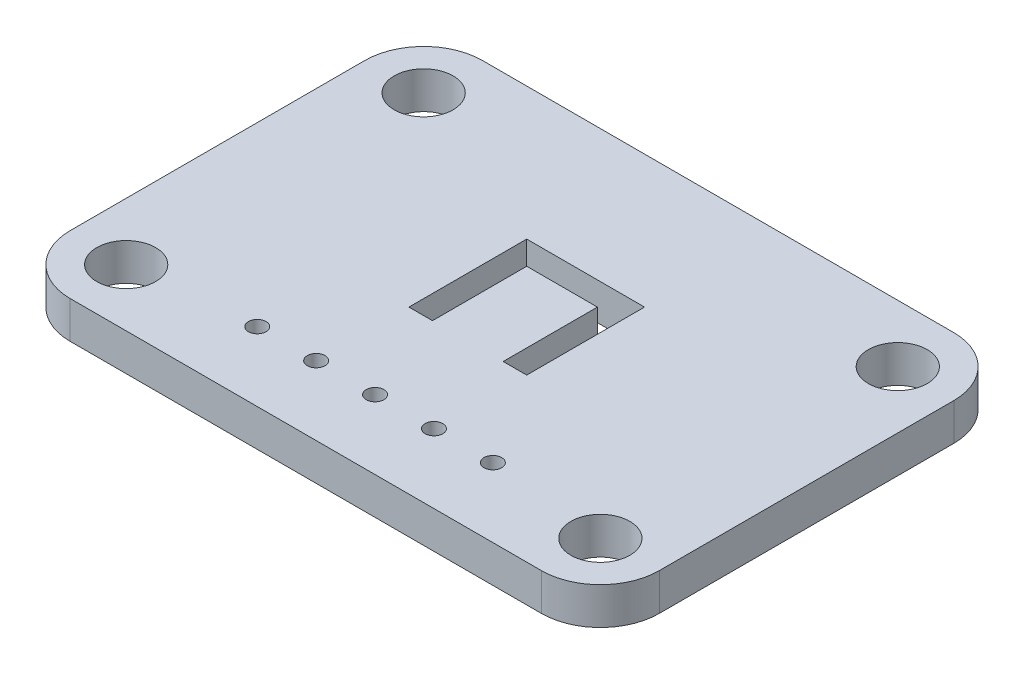
from build123d import *

# Parameters (mm, degrees)
SKETCH1_R           = 1.27
BOSS_EXTRUDE1_DEPTH = 1.6
SKETCH2_W           = 13.208
SKETCH2_H           = 2.667
BOSS_EXTRUDE2_DEPTH = 2.159
SKETCH3_R           = 0.381
CUT_EXTRUDE1_DEPTH  = 16.951557322
SKETCH4_W           = 5.111032259
SKETCH4_H           = 3.147597235
CUT_EXTRUDE2_DEPTH  = 27.997284697
CUT_EXTRUDE3_DEPTH  = 0.0254


with BuildPart() as part:
    # Sketch1 → Boss-Extrude1 (new body)
    with BuildSketch(Plane(origin=(0, 0, 0), x_dir=(1, 0, 0), z_dir=(0, 1, 0))):
        with BuildLine():
            Line((10.16, 8.89), (-10.16, 8.89))
            ThreePointArc((-10.16, 8.89), (-11.956051224, 8.146051224), (-12.7, 6.35))
            Line((-12.7, 6.35), (-12.7, -6.35))
            ThreePointArc((-12.7, -6.35), (-11.956051224, -8.146051224), (-10.16, -8.89))
            Line((-10.16, -8.89), (10.16, -8.89))
            ThreePointArc((10.16, -8.89), (11.956051224, -8.146051224), (12.7, -6.35))
            Line((12.7, -6.35), (12.7, 6.35))
            ThreePointArc((12.7, 6.35), (11.956051224, 8.146051224), (10.16, 8.89))
        make_face()
        with Locations(Location((-10.2235, 6.4135, 0), (0, 0, 270))):
            Circle(SKETCH1_R, mode=Mode.SUBTRACT)
        with Locations(Location((10.2235, 6.4135, 0), (0, 0, 270))):
            Circle(SKETCH1_R, mode=Mode.SUBTRACT)
        with Locations(Location((-10.2235, -6.4135, 0), (0, 0, 270))):
            Circle(SKETCH1_R, mode=Mode.SUBTRACT)
        with Locations(Location((10.2235, -6.4135, 0), (0, 0, 270))):
            Circle(SKETCH1_R, mode=Mode.SUBTRACT)
        Polygon((-2.54, -1.905), (-1.524, -1.905), (-1.524, 2.159), (1.524, 2.159), (1.524, -1.905), (2.54, -1.905), (2.54, 3.175), (-2.54, 3.175), align=None, mode=Mode.SUBTRACT)
    extrude(amount=BOSS_EXTRUDE1_DEPTH)

    # Sketch2 → Boss-Extrude2 (add)
    with BuildSketch(Plane.XZ):
        with Locations((0, 5.9055)):
            Rectangle(SKETCH2_W, SKETCH2_H)
    extrude(amount=BOSS_EXTRUDE2_DEPTH)

    # Sketch3 → Cut-Extrude1 (cut, through all)
    with BuildSketch(Plane.XZ.offset(2.159)):
        with Locations(Location((-5.08, 5.9055, 0), (0, 0, 270))):
            Circle(SKETCH3_R)
        with Locations(Location((-2.54, 5.9055, 0), (0, 0, 270))):
            Circle(SKETCH3_R)
        with Locations(Location((0, 5.9055, 0), (0, 0, 270))):
            Circle(SKETCH3_R)
        with Locations(Location((2.54, 5.9055, 0), (0, 0, 270))):
            Circle(SKETCH3_R)
        with Locations(Location((5.08, 5.9055, 0), (0, 0, 270))):
            Circle(SKETCH3_R)
    extrude(amount=-CUT_EXTRUDE1_DEPTH, mode=Mode.SUBTRACT)

    # Sketch4 → Cut-Extrude2 (cut, through all)
    with BuildSketch(Plane.ZY.offset(12.7)):
        with Locations((5.923321313, -1.573798618)):
            Rectangle(SKETCH4_W, SKETCH4_H)
    extrude(amount=-CUT_EXTRUDE2_DEPTH, mode=Mode.SUBTRACT)

    # Sketch5 → Cut-Extrude3 (cut)
    # profile 1 of 5: a face of its own
    with BuildSketch(Plane.XZ):
        with BuildLine():
            Line((-5.74673112, -6.610759593), (-5.478331681, -6.449847133))
            add(Edge.make_bspline(
                [(-5.478331681, -6.449847133), (-5.453368708, -6.491634111), (-5.405540617, -6.571696348), (-5.325756169, -6.679880427), (-5.2430856, -6.771830384), (-5.156916704, -6.847011306), (-5.067775451, -6.906201368), (-4.975079917, -6.948113392), (-4.879142474, -6.974253599), (-4.813851936, -6.977428677), (-4.78125636, -6.9790138)],
                knots=[0, 0, 0, 0, 1.272034388, 2.437168799, 3.508375237, 4.49857839, 5.41946034, 6.295179144, 7.148887113, 8, 8, 8, 8], degree=3))
            add(Edge.make_bspline(
                [(-4.78125636, -6.9790138), (-4.753418994, -6.97823849), (-4.69823135, -6.976701436), (-4.616985601, -6.961932422), (-4.53808068, -6.939242848), (-4.463142844, -6.906748146), (-4.393206108, -6.867433948), (-4.331877178, -6.819948487), (-4.278858203, -6.766784286), (-4.235488507, -6.707472878), (-4.202214475, -6.643685179), (-4.176640241, -6.578211281), (-4.162447924, -6.510022651), (-4.160310012, -6.464111731), (-4.15923112, -6.440942886)],
                knots=[0, 0, 0, 0, 1.095163259, 2.171163733, 3.241058638, 4.321873601, 5.38011039, 6.391990106, 7.366004449, 8.327778327, 9.272591725, 10.192022065, 11.087607919, 12, 12, 12, 12], degree=3))
            add(Edge.make_bspline(
                [(-4.15923112, -6.440942886), (-4.16056853, -6.414507973), (-4.16328729, -6.360769656), (-4.186266561, -6.281485685), (-4.222415521, -6.203024568), (-4.255764491, -6.154491277), (-4.273078275, -6.129294249)],
                knots=[0, 0, 0, 0, 0.938893495, 1.908633276, 2.914225137, 4, 4, 4, 4], degree=3))
            add(Edge.make_bspline(
                [(-4.273078275, -6.129294249), (-4.287293761, -6.111108916), (-4.317137395, -6.072931084), (-4.368443139, -6.016102906), (-4.428646685, -5.957484769), (-4.495687767, -5.894838339), (-4.572008498, -5.831077266), (-4.655218457, -5.763161043), (-4.747442101, -5.693672469), (-4.81212093, -5.647070213), (-4.845494141, -5.623024216)],
                knots=[0, 0, 0, 0, 0.722233717, 1.516239348, 2.393582979, 3.351407094, 4.387010283, 5.505090956, 6.712668013, 8, 8, 8, 8], degree=3))
            add(Edge.make_bspline(
                [(-4.845494141, -5.623024216), (-4.878898766, -5.599231141), (-4.942765865, -5.553740591), (-5.032081865, -5.486227134), (-5.111950771, -5.424501623), (-5.182017593, -5.367982984), (-5.242251513, -5.31666355), (-5.293127178, -5.271036133), (-5.333348584, -5.22986676), (-5.355714718, -5.203159257), (-5.36575656, -5.191168247)],
                knots=[0, 0, 0, 0, 1.452282411, 2.77665338, 3.964542531, 5.026858415, 5.96415736, 6.766646006, 7.446254459, 8, 8, 8, 8], degree=3))
            add(Edge.make_bspline(
                [(-5.36575656, -5.191168247), (-5.379792369, -5.172480163), (-5.407395671, -5.135727539), (-5.443831976, -5.078282847), (-5.474801074, -5.019478885), (-5.499078332, -4.959157636), (-5.519521902, -4.898165951), (-5.533272311, -4.835708035), (-5.541882364, -4.772064145), (-5.542764094, -4.729234755), (-5.543205479, -4.707794849)],
                knots=[0, 0, 0, 0, 1.068054152, 2.10047183, 3.106115577, 4.101338837, 5.06977816, 6.043150881, 7.020423561, 8, 8, 8, 8], degree=3))
            add(Edge.make_bspline(
                [(-5.543205479, -4.707794849), (-5.542021468, -4.674203554), (-5.539678753, -4.607738953), (-5.519866284, -4.5106467), (-5.488594445, -4.417949022), (-5.444784082, -4.330563647), (-5.388307769, -4.250765936), (-5.322951778, -4.177637987), (-5.245108501, -4.116162202), (-5.159698621, -4.062448406), (-5.06621177, -4.020406031), (-4.968248593, -3.988691428), (-4.865653392, -3.970721601), (-4.796163406, -3.968142807), (-4.760903796, -3.966834313)],
                knots=[0, 0, 0, 0, 1.005424448, 1.989358655, 2.955360095, 3.929531133, 4.905563448, 5.876582895, 6.856512386, 7.866279853, 8.892233794, 9.918561126, 10.94386622, 12, 12, 12, 12], degree=3))
            add(Edge.make_bspline(
                [(-4.760903796, -3.966834313), (-4.723489505, -3.96812477), (-4.649084422, -3.970691078), (-4.539638347, -3.993004553), (-4.434263983, -4.029925877), (-4.349497593, -4.071825588), (-4.283155731, -4.113673372), (-4.232561895, -4.151791356), (-4.181292493, -4.19567449), (-4.128933972, -4.245439663), (-4.076373517, -4.301543502), (-4.022830813, -4.363601769), (-3.968180655, -4.431235217), (-3.933023554, -4.479517442), (-3.91500035, -4.504269208)],
                knots=[0, 0, 0, 0, 1.286793592, 2.559021753, 3.825965368, 5.121522368, 5.803751409, 6.523245864, 7.299691795, 8.125521123, 9.008227632, 9.944561021, 10.946284179, 12, 12, 12, 12], degree=3))
            Line((-3.91500035, -4.504269208), (-4.17258749, -4.69952662))
            add(Edge.make_bspline(
                [(-4.17258749, -4.69952662), (-4.1881413, -4.679489023), (-4.218094302, -4.640901294), (-4.263568908, -4.586861601), (-4.306430181, -4.53749808), (-4.348658044, -4.494621857), (-4.388022267, -4.455884922), (-4.426228441, -4.422719999), (-4.462726745, -4.394802138), (-4.508734228, -4.365008337), (-4.566535301, -4.335474937), (-4.639092702, -4.310483988), (-4.714917394, -4.295466182), (-4.766560703, -4.293480548), (-4.792704677, -4.292475338)],
                knots=[0, 0, 0, 0, 1.181633172, 2.275549214, 3.290209073, 4.226197932, 5.078386478, 5.862611352, 6.581680152, 7.217281963, 8.414376989, 9.595101626, 10.782541182, 12, 12, 12, 12], degree=3))
            add(Edge.make_bspline(
                [(-4.792704677, -4.292475338), (-4.825503808, -4.293574523), (-4.888753843, -4.295694198), (-4.978552128, -4.31884447), (-5.059373046, -4.355295158), (-5.128817159, -4.406380888), (-5.186635702, -4.46690636), (-5.22845994, -4.53655575), (-5.253633303, -4.613465501), (-5.256705143, -4.667115432), (-5.258269581, -4.694438479)],
                knots=[0, 0, 0, 0, 1.14458467, 2.207223713, 3.21896685, 4.227309161, 5.202851033, 6.127160689, 7.046193047, 8, 8, 8, 8], degree=3))
            add(Edge.make_bspline(
                [(-5.258269581, -4.694438479), (-5.257912959, -4.711448749), (-5.257199132, -4.745497104), (-5.247243423, -4.795799465), (-5.234453317, -4.845974752), (-5.214185358, -4.89579738), (-5.186204261, -4.946138692), (-5.14946028, -4.997865554), (-5.103183919, -5.051433889), (-5.067735486, -5.086274864), (-5.049019782, -5.104669849)],
                knots=[0, 0, 0, 0, 0.858281714, 1.717966888, 2.583508476, 3.4729293, 4.427298488, 5.488583878, 6.674047936, 8, 8, 8, 8], degree=3))
            add(Edge.make_bspline(
                [(-5.049019782, -5.104669849), (-5.042069822, -5.110872009), (-5.02555831, -5.125606919), (-4.995372292, -5.149729916), (-4.955509896, -5.179486717), (-4.907012042, -5.216305211), (-4.848984507, -5.259014823), (-4.78142091, -5.307069457), (-4.705074376, -5.362029124), (-4.650898067, -5.400453464), (-4.622251953, -5.420770611)],
                knots=[0, 0, 0, 0, 0.420754252, 0.999615792, 1.744751191, 2.668019286, 3.750313428, 4.999500688, 6.413464383, 8, 8, 8, 8], degree=3))
            add(Edge.make_bspline(
                [(-4.622251953, -5.420770611), (-4.587793303, -5.445845273), (-4.521068903, -5.49439888), (-4.426129527, -5.56734739), (-4.340047287, -5.638692151), (-4.262519952, -5.707977552), (-4.192781614, -5.774678036), (-4.131605967, -5.839596064), (-4.078369672, -5.902266548), (-4.021057095, -5.982614527), (-3.96249393, -6.081294511), (-3.912200563, -6.202196913), (-3.880488347, -6.32356929), (-3.87634133, -6.405145777), (-3.874295222, -6.44539501)],
                knots=[0, 0, 0, 0, 1.163667725, 2.253281268, 3.268753668, 4.215851969, 5.092017293, 5.902905408, 6.650798638, 7.335211899, 8.59617414, 9.77448103, 10.901945474, 12, 12, 12, 12], degree=3))
            add(Edge.make_bspline(
                [(-3.874295222, -6.44539501), (-3.87489134, -6.47385967), (-3.876072001, -6.530236225), (-3.889643687, -6.613017616), (-3.909527954, -6.693418476), (-3.939497445, -6.770444985), (-3.97607631, -6.845506306), (-4.022491406, -6.916633472), (-4.076291949, -6.985400705), (-4.138008293, -7.049974301), (-4.205541361, -7.109252636), (-4.276918713, -7.161983999), (-4.352257175, -7.205951692), (-4.431148048, -7.241829956), (-4.513609453, -7.269891076), (-4.599613657, -7.29022275), (-4.689302428, -7.302701145), (-4.750262865, -7.303996328), (-4.78125636, -7.304654825)],
                knots=[0, 0, 0, 0, 0.983748083, 1.948392443, 2.894712957, 3.844097841, 4.80183111, 5.778335162, 6.776009319, 7.81870978, 8.863265674, 9.881300176, 10.883814829, 11.87499822, 12.874611388, 13.892143829, 14.928324115, 16, 16, 16, 16], degree=3))
            add(Edge.make_bspline(
                [(-4.78125636, -7.304654825), (-4.805236993, -7.304191111), (-4.852896246, -7.303269521), (-4.923389848, -7.295122217), (-4.992459332, -7.283595059), (-5.059238002, -7.265294295), (-5.124586226, -7.24309018), (-5.188219789, -7.215750407), (-5.25016953, -7.182986946), (-5.310782623, -7.145526459), (-5.36990491, -7.101931219), (-5.426981856, -7.051155262), (-5.483886189, -6.994598982), (-5.538938327, -6.930726543), (-5.593251822, -6.860569853), (-5.645755808, -6.783472523), (-5.69753708, -6.699854495), (-5.730026826, -6.641012595), (-5.74673112, -6.610759593)],
                knots=[0, 0, 0, 0, 0.915332311, 1.819136955, 2.706846663, 3.586547465, 4.459518054, 5.340707479, 6.227863349, 7.133153174, 8.059268498, 9.028702269, 10.047606654, 11.120612155, 12.245963614, 13.433783089, 14.680604001, 16, 16, 16, 16], degree=3))
        make_face()
    # profile 2 of 5: a face of its own
    with BuildSketch(Plane.XZ):
        Polygon((-3.223013171, -4.048244569), (-2.938077274, -4.048244569), (-2.938077274, -5.350808672), (-1.309872145, -5.350808672), (-1.309872145, -4.048244569), (-1.024936248, -4.048244569), (-1.024936248, -7.223244569), (-1.309872145, -7.223244569), (-1.309872145, -5.676449697), (-2.938077274, -5.676449697), (-2.938077274, -7.223244569), (-3.223013171, -7.223244569), align=None)
    # profile 3 of 5: a face of its own
    with BuildSketch(Plane.XZ):
        Polygon((-0.577179838, -4.373885595), (-0.577179838, -4.048244569), (1.091730419, -4.048244569), (1.091730419, -4.373885595), (0.399743239, -4.373885595), (0.399743239, -7.223244569), (0.114807342, -7.223244569), (0.114807342, -4.373885595), align=None)
    # profile 4 of 5: a face of its own
    with BuildSketch(Plane.XZ):
        Polygon((3.028404097, -3.966834313), (3.086281701, -3.966834313), (3.086281701, -6.164911236), (3.452627855, -6.164911236), (3.452627855, -6.490552261), (3.086281701, -6.490552261), (3.086281701, -7.223244569), (2.801345803, -7.223244569), (2.801345803, -6.490552261), (1.29525606, -6.490552261), align=None)
        Polygon((2.801345803, -6.164911236), (2.801345803, -4.786025018), (1.854951573, -6.164911236), align=None, mode=Mode.SUBTRACT)
    # profile 5 of 5: a face of its own
    with BuildSketch(Plane.XZ):
        with BuildLine():
            Line((5.732115034, -4.048244569), (5.732115034, -4.373885595))
            Line((5.732115034, -4.373885595), (4.652157101, -4.373885595))
            Line((4.652157101, -4.373885595), (4.481068359, -5.208976741))
            add(Edge.make_bspline(
                [(4.481068359, -5.208976741), (4.514683331, -5.199696423), (4.579807022, -5.181717274), (4.675927753, -5.161754897), (4.767179252, -5.149721244), (4.826393338, -5.148078126), (4.855046725, -5.147283031)],
                knots=[0, 0, 0, 0, 1.100273476, 2.13160584, 3.095893838, 4, 4, 4, 4], degree=3))
            add(Edge.make_bspline(
                [(4.855046725, -5.147283031), (4.89050126, -5.148050415), (4.960213735, -5.149559285), (5.062211923, -5.164048034), (5.15957819, -5.186853528), (5.252108911, -5.218712858), (5.339975268, -5.259452402), (5.422368842, -5.310343062), (5.500526377, -5.369791155), (5.57304573, -5.438139845), (5.638835638, -5.513361597), (5.6966805, -5.594240523), (5.745813707, -5.679990617), (5.785329535, -5.771431169), (5.816883895, -5.867551258), (5.837886062, -5.969362244), (5.851871219, -6.075904467), (5.85343367, -6.148752184), (5.854230419, -6.185899817)],
                knots=[0, 0, 0, 0, 1.052922333, 2.070308379, 3.05430497, 4.020497103, 4.973039431, 5.925935799, 6.892292201, 7.88610001, 8.88166317, 9.857072816, 10.836096531, 11.812156883, 12.81219415, 13.836441305, 14.89672472, 16, 16, 16, 16], degree=3))
            add(Edge.make_bspline(
                [(5.854230419, -6.185899817), (5.8536271, -6.211773546), (5.852428617, -6.263171342), (5.846333898, -6.339502152), (5.834599356, -6.414217008), (5.818844349, -6.487325821), (5.798395156, -6.55869018), (5.773640085, -6.628514352), (5.743345118, -6.696363745), (5.710115227, -6.762880353), (5.672698779, -6.826560428), (5.631171133, -6.886113437), (5.587296723, -6.942432749), (5.540087752, -6.99491435), (5.489105421, -7.043213373), (5.434967165, -7.087616457), (5.378104985, -7.128874521), (5.317639158, -7.165312812), (5.254917048, -7.198843494), (5.18903288, -7.226351274), (5.121486387, -7.250944396), (5.051305393, -7.270547325), (4.978648863, -7.285907571), (4.903397031, -7.296340258), (4.825944566, -7.303938884), (4.773443661, -7.304414551), (4.746923728, -7.304654825)],
                knots=[0, 0, 0, 0, 1.056347294, 2.098418968, 3.122841568, 4.141288669, 5.149314143, 6.15115421, 7.162517403, 8.180376062, 9.185164535, 10.17417709, 11.141909838, 12.097768115, 13.052685741, 14.0056014, 14.954263652, 15.917497458, 16.885230207, 17.854509472, 18.828990115, 19.81800267, 20.826176721, 21.857883937, 22.917946725, 24, 24, 24, 24], degree=3))
            add(Edge.make_bspline(
                [(4.746923728, -7.304654825), (4.715287864, -7.304028137), (4.653048039, -7.302795201), (4.561861525, -7.289897003), (4.474127561, -7.271424022), (4.390552398, -7.243632549), (4.310387037, -7.208809788), (4.234710715, -7.16479869), (4.161589761, -7.114924789), (4.093996699, -7.05606904), (4.031262224, -6.991738386), (3.975104177, -6.921926811), (3.925090147, -6.847786531), (3.882021048, -6.768957492), (3.845283557, -6.685646824), (3.816422817, -6.597542388), (3.793128881, -6.505104527), (3.783274207, -6.441465271), (3.77826888, -6.409142005)],
                knots=[0, 0, 0, 0, 1.0467383, 2.05933395, 3.04377827, 4.011590433, 4.970194871, 5.932262533, 6.905835911, 7.896367577, 8.894135286, 9.877477877, 10.858688626, 11.851381753, 12.8477658, 13.868841284, 14.917554742, 16, 16, 16, 16], degree=3))
            Line((3.77826888, -6.409142005), (4.063204778, -6.409142005))
            add(Edge.make_bspline(
                [(4.063204778, -6.409142005), (4.070215683, -6.439419215), (4.083691033, -6.497613695), (4.113269105, -6.579375697), (4.14943315, -6.652236708), (4.192435666, -6.717160544), (4.243734622, -6.77377442), (4.302272032, -6.82422704), (4.367901753, -6.869743051), (4.440829897, -6.907682275), (4.517767476, -6.94003893), (4.598292016, -6.96158511), (4.680210959, -6.976735206), (4.735617766, -6.978251732), (4.763460186, -6.9790138)],
                knots=[0, 0, 0, 0, 1.136247022, 2.183929868, 3.172523383, 4.106158343, 5.02341133, 5.958108904, 6.928429099, 7.938127109, 8.96079061, 9.975095812, 10.982467395, 12, 12, 12, 12], degree=3))
            add(Edge.make_bspline(
                [(4.763460186, -6.9790138), (4.790636775, -6.978269237), (4.844147701, -6.976803187), (4.92289803, -6.965519226), (4.998928281, -6.948140572), (5.07148824, -6.922132918), (5.141847637, -6.89052378), (5.2082267, -6.849960819), (5.272545738, -6.80327923), (5.332805545, -6.749797145), (5.387995617, -6.69086035), (5.436760098, -6.627834429), (5.477379155, -6.560599861), (5.511609383, -6.490320644), (5.537602018, -6.416226524), (5.556144908, -6.338664744), (5.567033397, -6.257443726), (5.568531253, -6.202045138), (5.569294521, -6.173815482)],
                knots=[0, 0, 0, 0, 1.027316725, 2.022795036, 3.002884548, 3.971462791, 4.93288096, 5.914575861, 6.907176829, 7.935150275, 8.956128384, 9.956726525, 10.942570165, 11.921478529, 12.907843606, 13.90538589, 14.932640048, 16, 16, 16, 16], degree=3))
            add(Edge.make_bspline(
                [(5.569294521, -6.173815482), (5.568697186, -6.148346765), (5.567527988, -6.098495374), (5.557975257, -6.025561808), (5.541359146, -5.956552691), (5.518296055, -5.891134779), (5.48901393, -5.829246371), (5.45323049, -5.770823595), (5.410274193, -5.716636475), (5.361205122, -5.666659658), (5.307449614, -5.620536093), (5.24808279, -5.581216815), (5.184347, -5.548138832), (5.117010149, -5.519592862), (5.044470562, -5.499090757), (4.96816476, -5.483698461), (4.887268746, -5.474794525), (4.831959622, -5.473559098), (4.803529297, -5.472924056)],
                knots=[0, 0, 0, 0, 1.045622112, 2.046656509, 3.013763289, 3.955457236, 4.890082067, 5.820317437, 6.762574623, 7.722996705, 8.69280354, 9.665887285, 10.63943826, 11.638615906, 12.663482002, 13.728887084, 14.832589034, 16, 16, 16, 16], degree=3))
            add(Edge.make_bspline(
                [(4.803529297, -5.472924056), (4.778919483, -5.473450735), (4.728106461, -5.474538194), (4.650162182, -5.482545088), (4.568254691, -5.495462162), (4.48269797, -5.513229686), (4.39323508, -5.536480735), (4.300054817, -5.564343174), (4.20296126, -5.597655273), (4.137540182, -5.622812353), (4.103909906, -5.635744569)],
                knots=[0, 0, 0, 0, 0.817624296, 1.688186739, 2.600797293, 3.572016777, 4.590301741, 5.671205678, 6.80286297, 8, 8, 8, 8], degree=3))
            Line((4.103909906, -5.635744569), (4.429550932, -4.048244569))
            Line((4.429550932, -4.048244569), (5.732115034, -4.048244569))
        make_face()
    extrude(amount=-CUT_EXTRUDE3_DEPTH, mode=Mode.SUBTRACT)


solid = part.part
